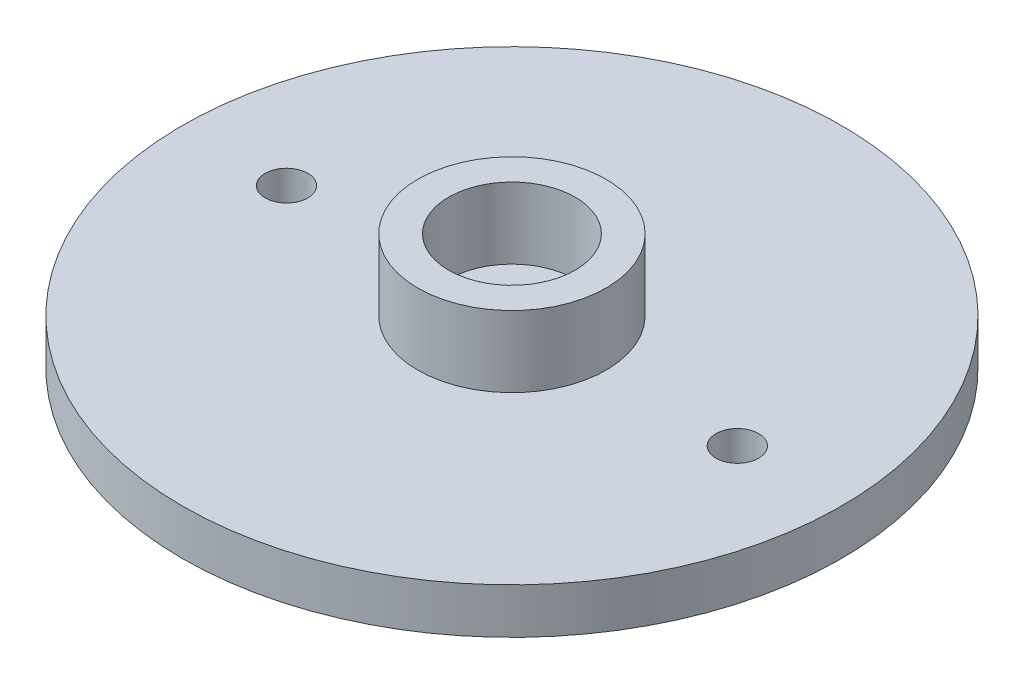
from build123d import *

# Parameters (mm, degrees)
SKETCH1_R           = 11.7729
SKETCH1_R_2         = 1.016
BOSS_EXTRUDE1_DEPTH = 1.6256
SKETCH2_R           = 0.762
CUT_EXTRUDE1_DEPTH  = 17.728566112
SKETCH3_R           = 3.3655
SKETCH3_R_2         = 2.2606
BOSS_EXTRUDE2_DEPTH = 2.54
SKETCH4_R           = 2.6924
BOSS_EXTRUDE3_DEPTH = 0.8636
SKETCH5_R           = 2.2606
CUT_EXTRUDE2_DEPTH  = 1.27


with BuildPart() as part:
    # Sketch1 → Boss-Extrude1 (new body)
    with BuildSketch(Plane(origin=(0, 0, 0), x_dir=(1, 0, 0), z_dir=(0, 1, 0))):
        with Locations(Location((0, 0, 0), (0, 0, 270))):
            Circle(SKETCH1_R)
        with Locations(Location((0, 0, 0), (0, 0, 270))):
            Circle(SKETCH1_R_2, mode=Mode.SUBTRACT)
    extrude(amount=BOSS_EXTRUDE1_DEPTH)

    # Sketch2 → Cut-Extrude1 (cut, through all)
    with BuildSketch(Plane(origin=(0, 1.6256, 0), x_dir=(1, 0, 0), z_dir=(0, 1, 0))):
        with Locations(Location((8.0518, 0, 0), (0, 0, 270))):
            Circle(SKETCH2_R)
        with Locations(Location((-8.0518, 0, 0), (0, 0, 270))):
            Circle(SKETCH2_R)
    extrude(amount=-CUT_EXTRUDE1_DEPTH, mode=Mode.SUBTRACT)

    # Sketch3 → Boss-Extrude2 (add)
    with BuildSketch(Plane(origin=(0, 1.6256, 0), x_dir=(1, 0, 0), z_dir=(0, 1, 0))):
        with Locations(Location((0, 0, 0), (0, 0, 270))):
            Circle(SKETCH3_R)
        with Locations(Location((0, 0, 0), (0, 0, 270))):
            Circle(SKETCH3_R_2, mode=Mode.SUBTRACT)
    extrude(amount=BOSS_EXTRUDE2_DEPTH)

    # Sketch4 → Boss-Extrude3 (add)
    with BuildSketch(Plane.XZ):
        with Locations(Location((0, 0, 0), (0, 0, 90))):
            Circle(SKETCH4_R)
    extrude(amount=BOSS_EXTRUDE3_DEPTH)

    # Sketch5 → Cut-Extrude2 (cut)
    with BuildSketch(Plane.XZ.offset(0.8636)):
        with Locations(Location((0, 0, 0), (0, 0, 90))):
            Circle(SKETCH5_R)
    extrude(amount=-CUT_EXTRUDE2_DEPTH, mode=Mode.SUBTRACT)


solid = part.part
